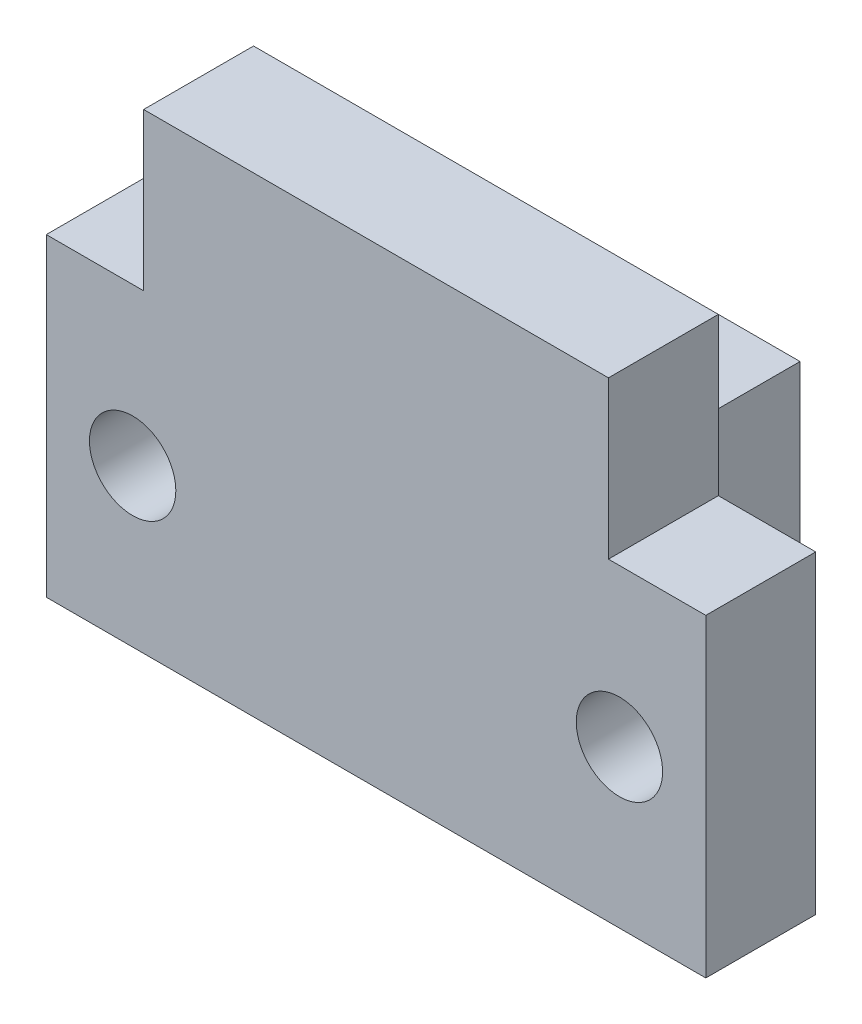
from build123d import *

# Parameters (mm, degrees)
SKETCH1_W           = 42
SKETCH1_H           = 7
SKETCH1_W_2         = 6
SKETCH1_H_2         = 10
BOSS_EXTRUDE1_DEPTH = 20
SKETCH6_R           = 2.75
CUT_EXTRUDE4_DEPTH  = 31.6757233
SKETCH7_R           = 4.5
CUT_EXTRUDE5_DEPTH  = 2
CUT_EXTRUDE6_REACH  = 41.284
SKETCH8_R           = 1.75
CUT_EXTRUDE7_REACH  = 41.284
SKETCH9_R           = 1.75
SKETCH10_W          = 29.6
SKETCH10_H          = 10
BOSS_EXTRUDE2_DEPTH = 7
SKETCH11_R          = 2.5
SKETCH11_R_2        = 1.75
BOSS_EXTRUDE3_DEPTH = 7.6


with BuildPart() as part:
    # Sketch1 → Boss-Extrude1 (new body)
    with BuildSketch(Plane(origin=(0, 0, 0), x_dir=(1, 0, 0), z_dir=(0, 1, 0))):
        Rectangle(SKETCH1_W, SKETCH1_H)
        with Locations((-7, 8.5)):
            Rectangle(SKETCH1_W_2, SKETCH1_H_2)
        with Locations((7, 8.5)):
            Rectangle(SKETCH1_W_2, SKETCH1_H_2)
    extrude(amount=BOSS_EXTRUDE1_DEPTH)

    # Sketch6 → Cut-Extrude4 (cut, through all)
    with BuildSketch(Plane(origin=(0, 0, -3.5), x_dir=(-1, 0, 0), z_dir=(0, 0, -1))):
        with Locations((-15.5, 10)):
            Circle(SKETCH6_R)
        with Locations(Location((15.5, 10, 0), (0, 0, 180))):
            Circle(SKETCH6_R)
    extrude(amount=-CUT_EXTRUDE4_DEPTH, mode=Mode.SUBTRACT)

    # Sketch7 → Cut-Extrude5 (cut)
    with BuildSketch(Plane(origin=(0, 0, -3.5), x_dir=(-1, 0, 0), z_dir=(0, 0, -1))):
        with Locations((-15.5, 10)):
            Circle(SKETCH7_R)
        with Locations((15.5, 10)):
            Circle(SKETCH7_R)
    extrude(amount=-CUT_EXTRUDE5_DEPTH, mode=Mode.SUBTRACT)

    # Sketch8 → Cut-Extrude6 (cut, up to next)
    with BuildSketch(Plane(origin=(10, 0, 0), x_dir=(0, 0, -1), z_dir=(1, 0, 0)), mode=Mode.PRIVATE) as cut_extrude6_sk1:
        with Locations((9.5, 10)):
            Circle(SKETCH8_R)
    cut_extrude6_tool1 = extrude(cut_extrude6_sk1.sketch, amount=-CUT_EXTRUDE6_REACH, mode=Mode.PRIVATE) & part.part
    add(cut_extrude6_tool1.solids().sort_by_distance((10, 10, -9.5))[0], mode=Mode.SUBTRACT)

    # Sketch9 → Cut-Extrude7 (cut, up to next)
    with BuildSketch(Plane.ZY.offset(10), mode=Mode.PRIVATE) as cut_extrude7_sk1:
        with Locations(Location((-9.5, 10, 0), (0, 0, 180))):
            Circle(SKETCH9_R)
    cut_extrude7_tool1 = extrude(cut_extrude7_sk1.sketch, amount=-CUT_EXTRUDE7_REACH, mode=Mode.PRIVATE) & part.part
    add(cut_extrude7_tool1.solids().sort_by_distance((-10, 10, -9.5))[0], mode=Mode.SUBTRACT)

    # Sketch10 → Boss-Extrude2 (add)
    with BuildSketch(Plane.XY.offset(3.5)):
        with Locations((0, 25)):
            Rectangle(SKETCH10_W, SKETCH10_H)
    extrude(amount=-BOSS_EXTRUDE2_DEPTH)


with BuildPart() as body_2:
    # Sketch11 → Boss-Extrude3 (new body)
    with BuildSketch(Plane.ZY.offset(-4)):
        with Locations(Location((-9.5, 10, 0), (0, 0, 180))):
            Circle(SKETCH11_R)
        with Locations(Location((-9.5, 10, 0), (0, 0, 180))):
            Circle(SKETCH11_R_2, mode=Mode.SUBTRACT)
    extrude(amount=BOSS_EXTRUDE3_DEPTH)


solid = Compound([part.part, body_2.part])
